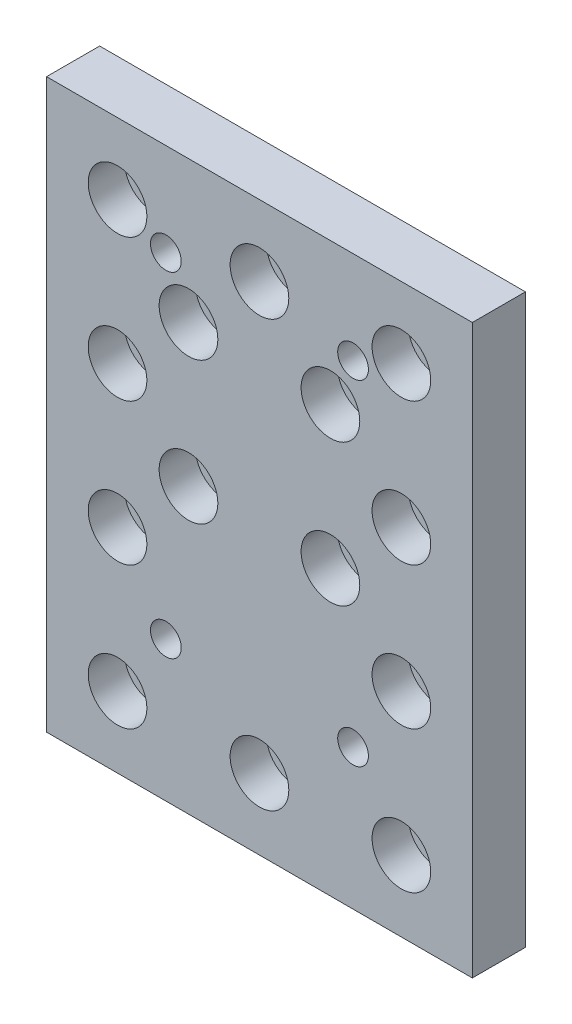
from build123d import *

# Parameters (mm, degrees)
SKETCH1_W           = 76.2
SKETCH1_H           = 101.6
SKETCH1_R           = 3.175
SKETCH1_R_2         = 2.75
BOSS_EXTRUDE1_DEPTH = 9.5
SKETCH_1_R          = 5.25
CUT_EXTRUDE_1_DEPTH = 6.5


with BuildPart() as part:
    # Sketch1 → Boss-Extrude1 (new body)
    with BuildSketch(Plane.XY):
        with Locations((-26.419970967, 29.8958)):
            Rectangle(SKETCH1_W, SKETCH1_H)
        with Locations((-1.019970967, 17.1958)):
            Circle(SKETCH1_R, mode=Mode.SUBTRACT)
        with Locations((-13.719970967, 29.8958)):
            Circle(SKETCH1_R, mode=Mode.SUBTRACT)
        with Locations((-1.019970967, 42.5958)):
            Circle(SKETCH1_R, mode=Mode.SUBTRACT)
        with Locations((-13.719970967, 55.2958)):
            Circle(SKETCH1_R, mode=Mode.SUBTRACT)
        with Locations((-1.019970967, 67.9958)):
            Circle(SKETCH1_R, mode=Mode.SUBTRACT)
        with Locations((-26.419970967, 67.9958)):
            Circle(SKETCH1_R, mode=Mode.SUBTRACT)
        with Locations((-39.119970967, 55.2958)):
            Circle(SKETCH1_R, mode=Mode.SUBTRACT)
        with Locations((-51.819970967, 67.9958)):
            Circle(SKETCH1_R, mode=Mode.SUBTRACT)
        with Locations((-51.819970967, 42.5958)):
            Circle(SKETCH1_R, mode=Mode.SUBTRACT)
        with Locations((-51.819970967, 17.1958)):
            Circle(SKETCH1_R, mode=Mode.SUBTRACT)
        with Locations((-39.119970967, 29.8958)):
            Circle(SKETCH1_R, mode=Mode.SUBTRACT)
        with Locations((-1.019970967, -8.2042)):
            Circle(SKETCH1_R, mode=Mode.SUBTRACT)
        with Locations((-26.419970967, -8.2042)):
            Circle(SKETCH1_R, mode=Mode.SUBTRACT)
        with Locations((-51.819970967, -8.2042)):
            Circle(SKETCH1_R, mode=Mode.SUBTRACT)
        with Locations((-43.169970967, 4.207209087)):
            Circle(SKETCH1_R_2, mode=Mode.SUBTRACT)
        with Locations((-9.669970967, 4.207209087)):
            Circle(SKETCH1_R_2, mode=Mode.SUBTRACT)
        with Locations((-9.669970967, 64.107209087)):
            Circle(SKETCH1_R_2, mode=Mode.SUBTRACT)
        with Locations((-43.169970967, 64.107209087)):
            Circle(SKETCH1_R_2, mode=Mode.SUBTRACT)
    extrude(amount=BOSS_EXTRUDE1_DEPTH)

    # 草图1 → 切除-拉伸1 (cut)
    with BuildSketch(Plane.XY.offset(9.5)):
        with Locations((-51.819970967, -8.2042)):
            Circle(SKETCH_1_R)
        with Locations((-26.419970967, -8.2042)):
            Circle(SKETCH_1_R)
        with Locations((-1.019970967, -8.2042)):
            Circle(SKETCH_1_R)
        with Locations((-1.019970967, 17.1958)):
            Circle(SKETCH_1_R)
        with Locations((-51.819970967, 17.1958)):
            Circle(SKETCH_1_R)
        with Locations((-39.119970967, 29.8958)):
            Circle(SKETCH_1_R)
        with Locations((-13.719970967, 29.8958)):
            Circle(SKETCH_1_R)
        with Locations((-1.019970967, 42.5958)):
            Circle(SKETCH_1_R)
        with Locations((-51.819970967, 42.5958)):
            Circle(SKETCH_1_R)
        with Locations((-39.119970967, 55.2958)):
            Circle(SKETCH_1_R)
        with Locations((-13.719970967, 55.2958)):
            Circle(SKETCH_1_R)
        with Locations((-1.019970967, 67.9958)):
            Circle(SKETCH_1_R)
        with Locations((-26.419970967, 67.9958)):
            Circle(SKETCH_1_R)
        with Locations((-51.819970967, 67.9958)):
            Circle(SKETCH_1_R)
    extrude(amount=-CUT_EXTRUDE_1_DEPTH, mode=Mode.SUBTRACT)


solid = part.part
